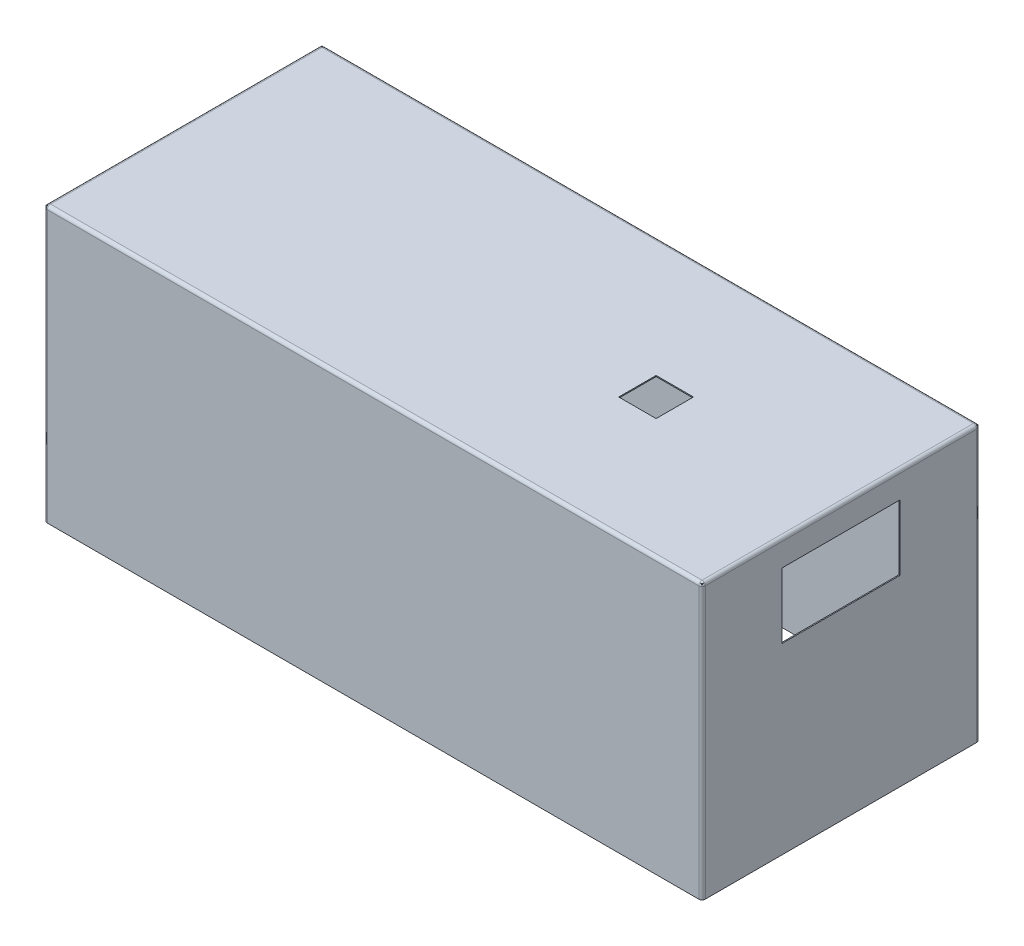
from build123d import *

# Parameters (mm, degrees)
SKETCH2_W           = 1006.2
SKETCH2_H           = 425
SKETCH2_W_2         = 1003.025
SKETCH2_H_2         = 421.825
BOSS_EXTRUDE1_DEPTH = 420
BOSS_EXTRUDE2_START = 420
SKETCH3_W           = 1006.2
SKETCH3_H           = 425
BOSS_EXTRUDE2_DEPTH = 1.5875
FILLET2_R           = 5
CUT_EXTRUDE1_REACH  = 1112.853
SKETCH4_W           = 80
SKETCH4_H           = 80
SKETCH7_W           = 57.15
SKETCH7_H           = 57.15
CUT_EXTRUDE2_DEPTH  = 420
SKETCH8_W           = 180
SKETCH8_H           = 100
CUT_EXTRUDE3_DEPTH  = 503.1
SKETCH9_W           = 180
SKETCH9_H           = 100
CUT_EXTRUDE4_DEPTH  = 503.1


with BuildPart() as part:
    # Sketch2 → Boss-Extrude1 (new body)
    with BuildSketch(Plane(origin=(0, 0, 0), x_dir=(1, 0, 0), z_dir=(0, 1, 0))):
        Rectangle(SKETCH2_W, SKETCH2_H)
        Rectangle(SKETCH2_W_2, SKETCH2_H_2, mode=Mode.SUBTRACT)
    extrude(amount=BOSS_EXTRUDE1_DEPTH)

    # Sketch3 → Boss-Extrude2 (add)
    with BuildSketch(Plane(origin=(0, 0, 0), x_dir=(1, 0, 0), z_dir=(0, 1, 0)).offset(BOSS_EXTRUDE2_START)):
        Rectangle(SKETCH3_W, SKETCH3_H)
    extrude(amount=-BOSS_EXTRUDE2_DEPTH)

    # Fillet2
    fillet2_edges = [part.edges().sort_by_distance(p)[0] for p in [
        (-503.1, 420, 0),
        (0, 420, 212.5),
        (503.1, 420, 0),
        (503.1, 210, 212.5),
        (-503.1, 210, 212.5),
        (-503.1, 210, -212.5),
        (503.1, 210, -212.5),
        (0, 420, -212.5),
    ]]
    fillet(fillet2_edges, radius=FILLET2_R)

    # Sketch4 → Cut-Extrude1 (cut, up to next)
    with BuildSketch(Plane.ZY.offset(503.1), mode=Mode.PRIVATE) as cut_extrude1_sk1:
        with Locations((0, 40)):
            Rectangle(SKETCH4_W, SKETCH4_H)
    cut_extrude1_tool1 = extrude(cut_extrude1_sk1.sketch, amount=-CUT_EXTRUDE1_REACH, mode=Mode.PRIVATE) & part.part
    add(cut_extrude1_tool1.solids().sort_by_distance((-503.1, 40, 0))[0], mode=Mode.SUBTRACT)

    # Sketch7 → Cut-Extrude2 (cut)
    with BuildSketch(Plane(origin=(0, 0, 0), x_dir=(1, 0, 0), z_dir=(0, 1, 0))):
        with Locations((220.4, 0)):
            Rectangle(SKETCH7_W, SKETCH7_H)
    extrude(amount=CUT_EXTRUDE2_DEPTH, mode=Mode.SUBTRACT)

    # Sketch8 → Cut-Extrude3 (cut)
    with BuildSketch(Plane(origin=(0, 0, 0), x_dir=(0, 0, -1), z_dir=(1, 0, 0))):
        with Locations((0, 330)):
            Rectangle(SKETCH8_W, SKETCH8_H)
    extrude(amount=CUT_EXTRUDE3_DEPTH, mode=Mode.SUBTRACT)

    # Sketch9 → Cut-Extrude4 (cut)
    with BuildSketch(Plane(origin=(0, 0, 0), x_dir=(0, 0, -1), z_dir=(1, 0, 0))):
        with Locations((0, 130)):
            Rectangle(SKETCH9_W, SKETCH9_H)
    extrude(amount=-CUT_EXTRUDE4_DEPTH, mode=Mode.SUBTRACT)


solid = part.part
